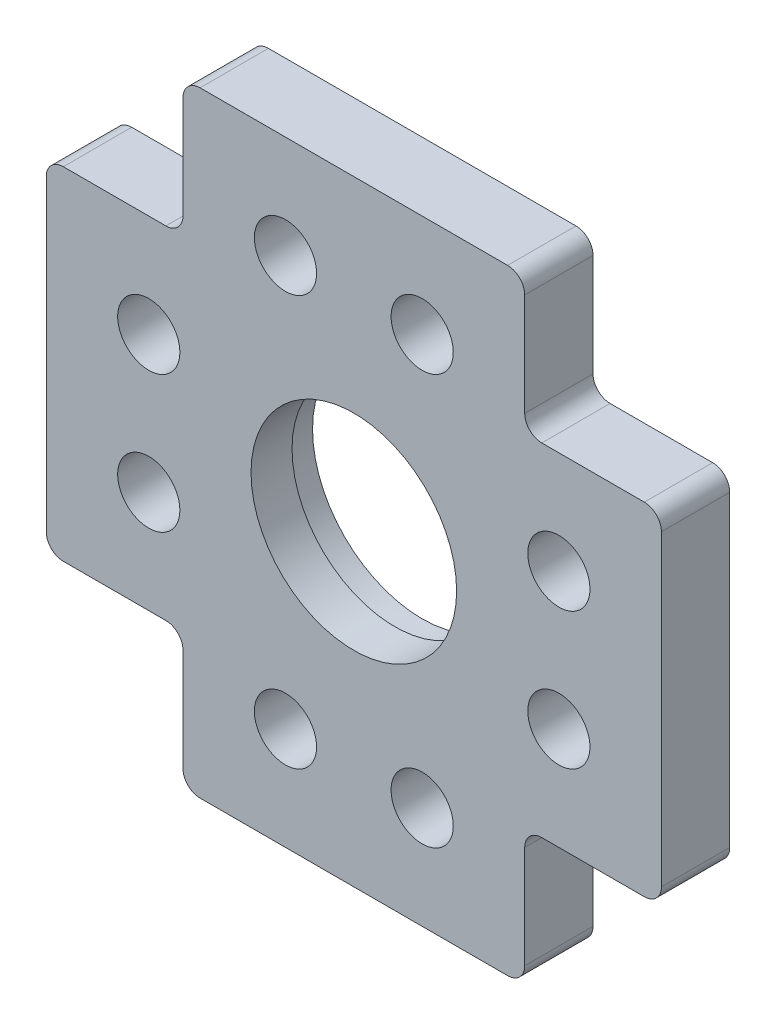
from build123d import *

# Parameters (mm, degrees)
SKETCH_1_R               = 15.04
EXTRUDE_1_DEPTH          = 10
FILLET_1_R               = 2.5
SKETCH_2_R               = 16.04
CUT_EXTRUDE_1_DEPTH      = 4
FILLET_2_R               = 2.5
SKETCH_5_R               = 4.55
CUT_EXTRUDE_2_DEPTH      = 76.6565237
PATTERN_CIRCULAR_1_COUNT = 4


with BuildPart() as part:
    # 스케치1 → 보스-돌출1 (new body)
    with BuildSketch(Plane.XY):
        Polygon((-30.009087535, 25), (-10.009087535, 25), (-10.009087535, 45), (39.990912465, 45), (39.990912465, 25), (59.990912465, 25), (59.990912465, -25), (39.990912465, -25), (39.990912465, -45), (-10.009087535, -45), (-10.009087535, -25), (-30.009087535, -25), align=None)
        with Locations((14.990912465, 0)):
            Circle(SKETCH_1_R, mode=Mode.SUBTRACT)
    extrude(amount=EXTRUDE_1_DEPTH)

    # 필렛1
    fillet_1_edges = [part.edges().sort_by_distance(p)[0] for p in [
        (-10.009087535, 25, 5),
        (39.990912465, 25, 5),
        (39.990912465, -25, 5),
        (-10.009087535, -25, 5),
    ]]
    fillet(fillet_1_edges, radius=FILLET_1_R)

    # 스케치2 → 컷-돌출1 (cut)
    with BuildSketch(Plane(origin=(0, 0, 0), x_dir=(-1, 0, 0), z_dir=(0, 0, -1))):
        with Locations((-14.990912465, 0)):
            Circle(SKETCH_2_R)
    extrude(amount=-CUT_EXTRUDE_1_DEPTH, mode=Mode.SUBTRACT)

    # 필렛2
    fillet_2_edges = [part.edges().sort_by_distance(p)[0] for p in [
        (-30.009087535, 25, 5),
        (-10.009087535, 45, 5),
        (39.990912465, 45, 5),
        (59.990912465, 25, 5),
        (59.990912465, -25, 5),
        (39.990912465, -45, 5),
        (-10.009087535, -45, 5),
        (-30.009087535, -25, 5),
    ]]
    fillet(fillet_2_edges, radius=FILLET_2_R)

    # 스케치5 → 컷-돌출2 (cut, through all)
    with BuildSketch(Plane.XY.offset(10)):
        with Locations((-15.009087535, -10)):
            Circle(SKETCH_5_R)
        with Locations((-15.009087535, 10)):
            Circle(SKETCH_5_R)
    cut_extrude_2 = extrude(amount=-CUT_EXTRUDE_2_DEPTH, mode=Mode.SUBTRACT)

    # 원형 패턴1: 컷-돌출2 ×4 about axis
    pattern_circular_1_axis = Axis((14.990912465, 0, 0), (0, 0, 1))
    for i in range(1, PATTERN_CIRCULAR_1_COUNT):
        add(cut_extrude_2.rotate(pattern_circular_1_axis, i * 360 / PATTERN_CIRCULAR_1_COUNT), mode=Mode.SUBTRACT)


solid = part.part
